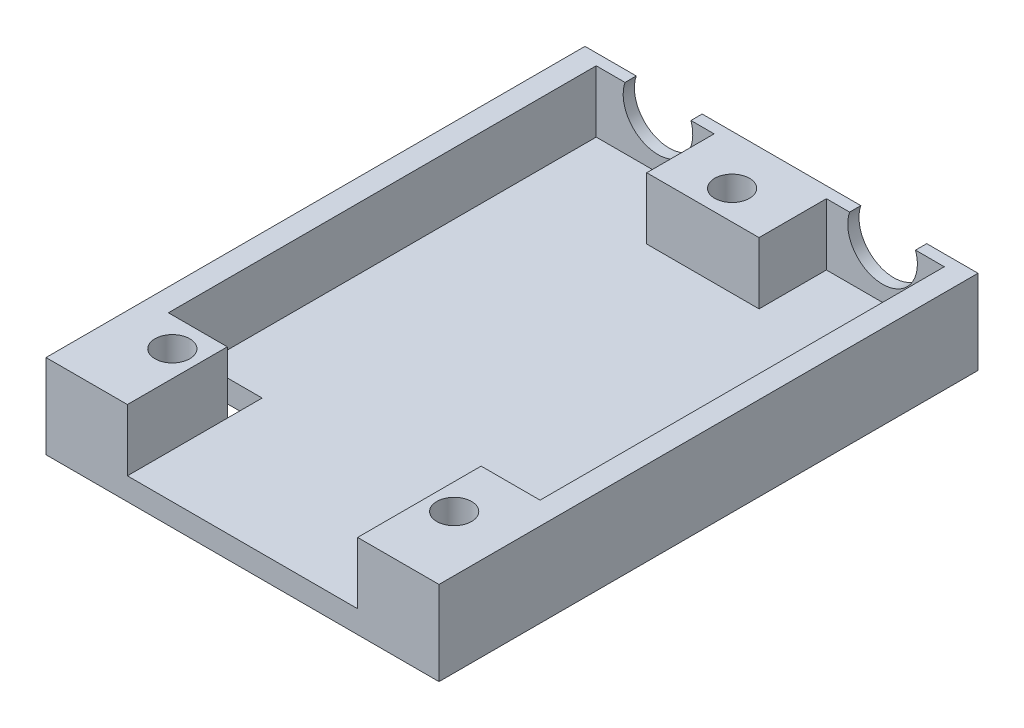
from build123d import *

# Parameters (mm, degrees)
SKETCH1_W           = 35
SKETCH1_H           = 48
BOSS_EXTRUDE1_DEPTH = 2
SKETCH2_W           = 35
SKETCH2_H           = 48
SKETCH2_W_2         = 31
SKETCH2_H_2         = 44
BOSS_EXTRUDE2_DEPTH = 5.5
SKETCH3_W           = 10
SKETCH3_H           = 6
SKETCH3_W_2         = 5.25
SKETCH3_H_2         = 8
BOSS_EXTRUDE3_DEPTH = 5.5
SKETCH4_W           = 20.5
SKETCH4_H           = 5.5
CUT_EXTRUDE1_DEPTH  = 3
SKETCH5_W           = 4.9
SKETCH5_H           = 4.9
BOSS_EXTRUDE4_DEPTH = 2
CUT_EXTRUDE2_DEPTH  = 2
CUT_EXTRUDE3_START  = -7.5
SKETCH7_W           = 5.25
SKETCH7_H           = 3.1
CUT_EXTRUDE3_DEPTH  = 7.5
CUT_EXTRUDE4_START  = 7.5
SKETCH8_R           = 1.55
CUT_EXTRUDE4_DEPTH  = 5.5


with BuildPart() as part:
    # Sketch1 → Boss-Extrude1 (new body)
    with BuildSketch(Plane(origin=(0, 0, 0), x_dir=(1, 0, 0), z_dir=(0, 1, 0))):
        Rectangle(SKETCH1_W, SKETCH1_H)
    extrude(amount=BOSS_EXTRUDE1_DEPTH)

    # Sketch2 → Boss-Extrude2 (add)
    with BuildSketch(Plane(origin=(0, 2, 0), x_dir=(1, 0, 0), z_dir=(0, 1, 0))):
        Rectangle(SKETCH2_W, SKETCH2_H)
        with Locations((0, 1)):
            Rectangle(SKETCH2_W_2, SKETCH2_H_2, mode=Mode.SUBTRACT)
    extrude(amount=BOSS_EXTRUDE2_DEPTH)

    # Sketch3 → Boss-Extrude3 (add)
    with BuildSketch(Plane(origin=(0, 2, 0), x_dir=(1, 0, 0), z_dir=(0, 1, 0))):
        with Locations((0, 20)):
            Rectangle(SKETCH3_W, SKETCH3_H)
        with Locations((-12.875, -17)):
            Rectangle(SKETCH3_W_2, SKETCH3_H_2)
        with Locations((12.875, -17)):
            Rectangle(SKETCH3_W_2, SKETCH3_H_2)
    extrude(amount=BOSS_EXTRUDE3_DEPTH)

    # Sketch4 → Cut-Extrude1 (cut)
    with BuildSketch(Plane.XY.offset(24)):
        with Locations((0, 4.75)):
            Rectangle(SKETCH4_W, SKETCH4_H)
    extrude(amount=-CUT_EXTRUDE1_DEPTH, mode=Mode.SUBTRACT)

    # Sketch5 → Boss-Extrude4 (add)
    with BuildSketch(Plane.XZ):
        with Locations((0, 6.05)):
            Rectangle(SKETCH5_W, SKETCH5_H)
        with Locations((0, -6.05)):
            Rectangle(SKETCH5_W, SKETCH5_H)
    extrude(amount=BOSS_EXTRUDE4_DEPTH)

    # Sketch6 → Cut-Extrude2 (cut)
    with BuildSketch(Plane(origin=(0, 0, -24), x_dir=(-1, 0, 0), z_dir=(0, 0, -1))):
        with BuildLine():
            ThreePointArc((-12.93428015, 7.5), (-10, 3.4), (-7.06571985, 7.5))
            Line((-7.06571985, 7.5), (-12.93428015, 7.5))
        make_face()
        with BuildLine():
            Line((12.93428015, 7.5), (7.06571985, 7.5))
            ThreePointArc((7.06571985, 7.5), (10, 3.4), (12.93428015, 7.5))
        make_face()
    extrude(amount=-CUT_EXTRUDE2_DEPTH, mode=Mode.SUBTRACT)

    # Sketch7 → Cut-Extrude3 (cut)
    with BuildSketch(Plane(origin=(0, 7.5, 0), x_dir=(1, 0, 0), z_dir=(0, 1, 0)).offset(CUT_EXTRUDE3_START)):
        with Locations((-12.875, -13.55)):
            Rectangle(SKETCH7_W, SKETCH7_H)
    extrude(amount=CUT_EXTRUDE3_DEPTH, mode=Mode.SUBTRACT)

    # Sketch8 → Cut-Extrude4 (cut)
    with BuildSketch(Plane(origin=(0, 0, 0), x_dir=(1, 0, 0), z_dir=(0, 1, 0)).offset(CUT_EXTRUDE4_START)):
        with Locations(Location((-12.55, -17.7, 0), (0, 0, 270))):
            Circle(SKETCH8_R)
        with Locations(Location((12.55, -17.7, 0), (0, 0, 270))):
            Circle(SKETCH8_R)
        with Locations(Location((0, 19.6, 0), (0, 0, 270))):
            Circle(SKETCH8_R)
    extrude(amount=-CUT_EXTRUDE4_DEPTH, mode=Mode.SUBTRACT)


solid = part.part
